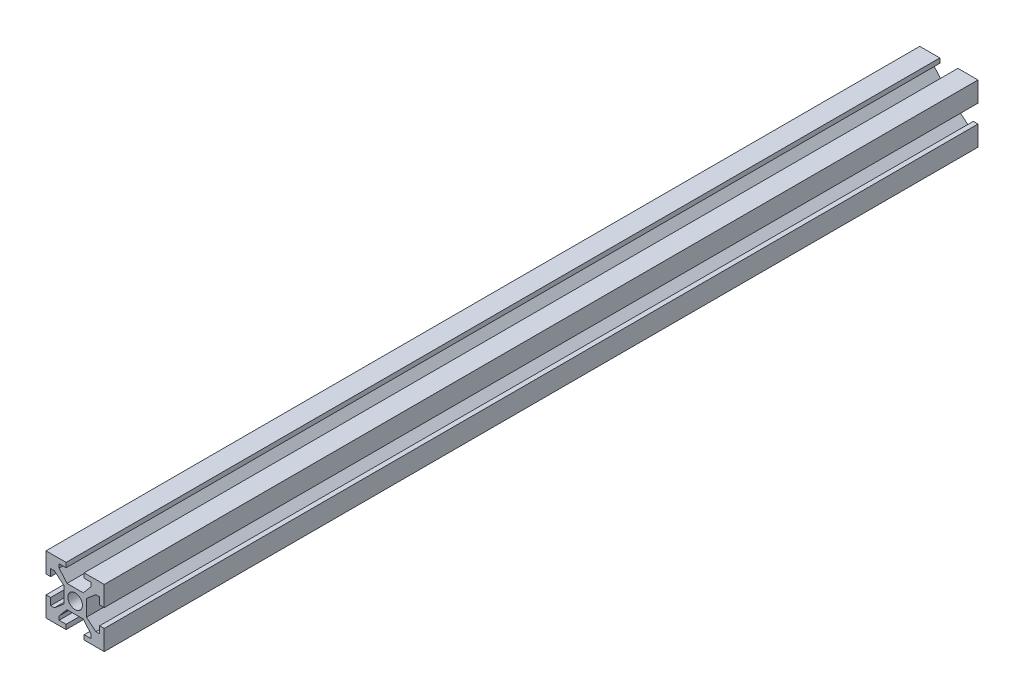
from build123d import *

# Parameters (mm, degrees)
SKETCH_1_R      = 2.5
EXTRUDE_1_DEPTH = 300


with BuildPart() as part:
    # 草图1 → 凸台-拉伸1 (new body)
    with BuildSketch(Plane.XY):
        Polygon((-20, 20), (-13.1, 20), (-13.1, 18.4), (-15.5, 18.4), (-15.5, 17.104298633), (-12.797022805, 13.9), (-7.202977195, 13.9), (-4.5, 17.104298633), (-4.5, 18.4), (-6.9, 18.4), (-6.9, 20), (0, 20), (0, 13.1), (-1.6, 13.1), (-1.6, 15.5), (-2.895701367, 15.5), (-6.1, 12.797022805), (-6.1, 7.202977195), (-2.895701367, 4.5), (-1.6, 4.5), (-1.6, 6.9), (0, 6.9), (0, 0), (-6.9, 0), (-6.9, 1.6), (-4.5, 1.6), (-4.5, 2.895701367), (-7.202977195, 6.1), (-12.797022805, 6.1), (-15.5, 2.895701367), (-15.5, 1.6), (-13.1, 1.6), (-13.1, 0), (-20, 0), (-20, 6.9), (-18.4, 6.9), (-18.4, 4.5), (-17.104298633, 4.5), (-13.9, 7.202977195), (-13.9, 12.797022805), (-17.104298633, 15.5), (-18.4, 15.5), (-18.4, 13.1), (-20, 13.1), align=None)
        with Locations((-10, 10)):
            Circle(SKETCH_1_R, mode=Mode.SUBTRACT)
    extrude(amount=EXTRUDE_1_DEPTH)


solid = part.part
